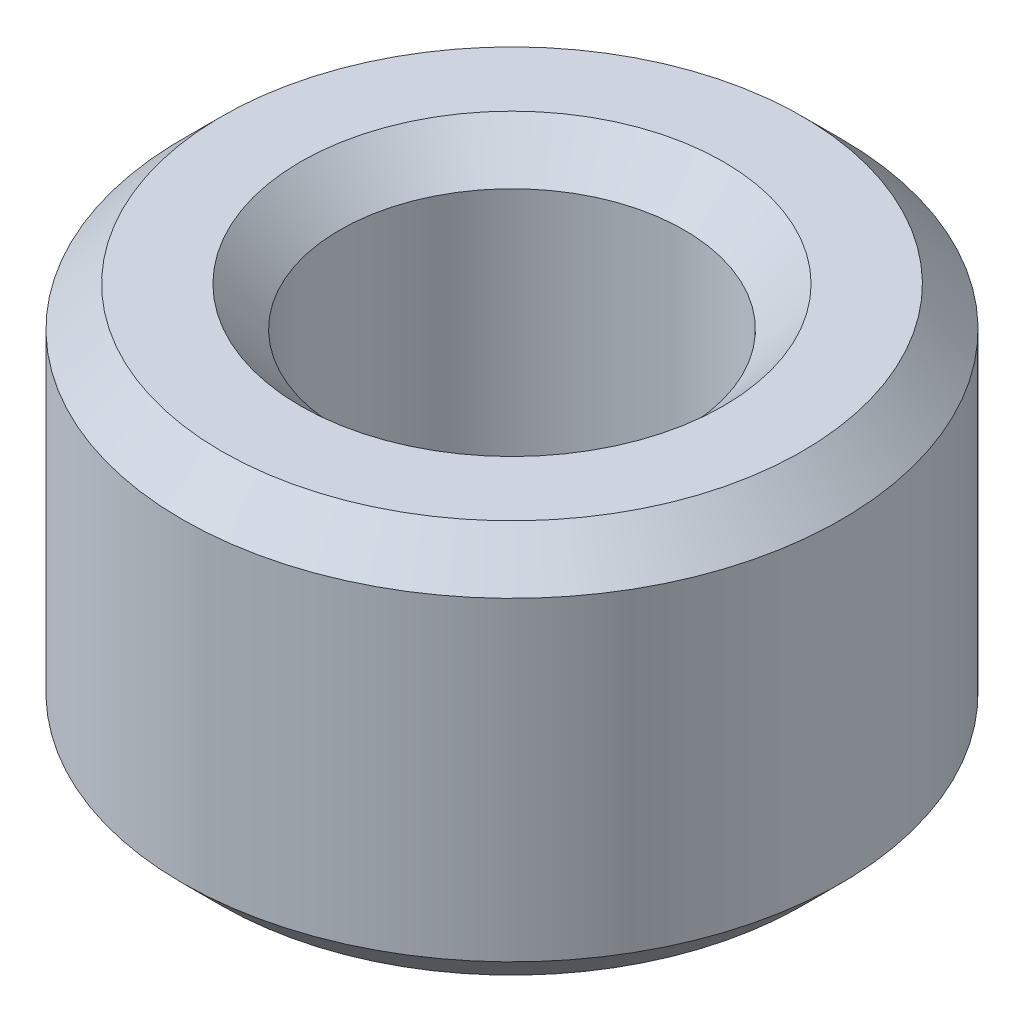
from build123d import *

# Parameters (mm, degrees)
SKETCH2_R           = 3.35
SKETCH2_R_2         = 1.75
BOSS_EXTRUDE1_DEPTH = 4
CHAMFER1_SIZE       = 0.4


with BuildPart() as part:
    # Sketch2 → Boss-Extrude1 (new body)
    with BuildSketch(Plane(origin=(0, 0, 0), x_dir=(1, 0, 0), z_dir=(0, 1, 0))):
        with Locations(Location((0, 0, 0), (0, 0, 270))):
            Circle(SKETCH2_R)
        with Locations(Location((0, 0, 0), (0, 0, 270))):
            Circle(SKETCH2_R_2, mode=Mode.SUBTRACT)
    extrude(amount=BOSS_EXTRUDE1_DEPTH)

    # Chamfer1
    chamfer1_edges = [part.edges().sort_by_distance(p)[0] for p in [
        (0, 0, -3.35),
        (0, 4, -3.35),
        (0, 0, -1.75),
        (0, 4, -1.75),
    ]]
    chamfer(chamfer1_edges, length=CHAMFER1_SIZE)


solid = part.part
